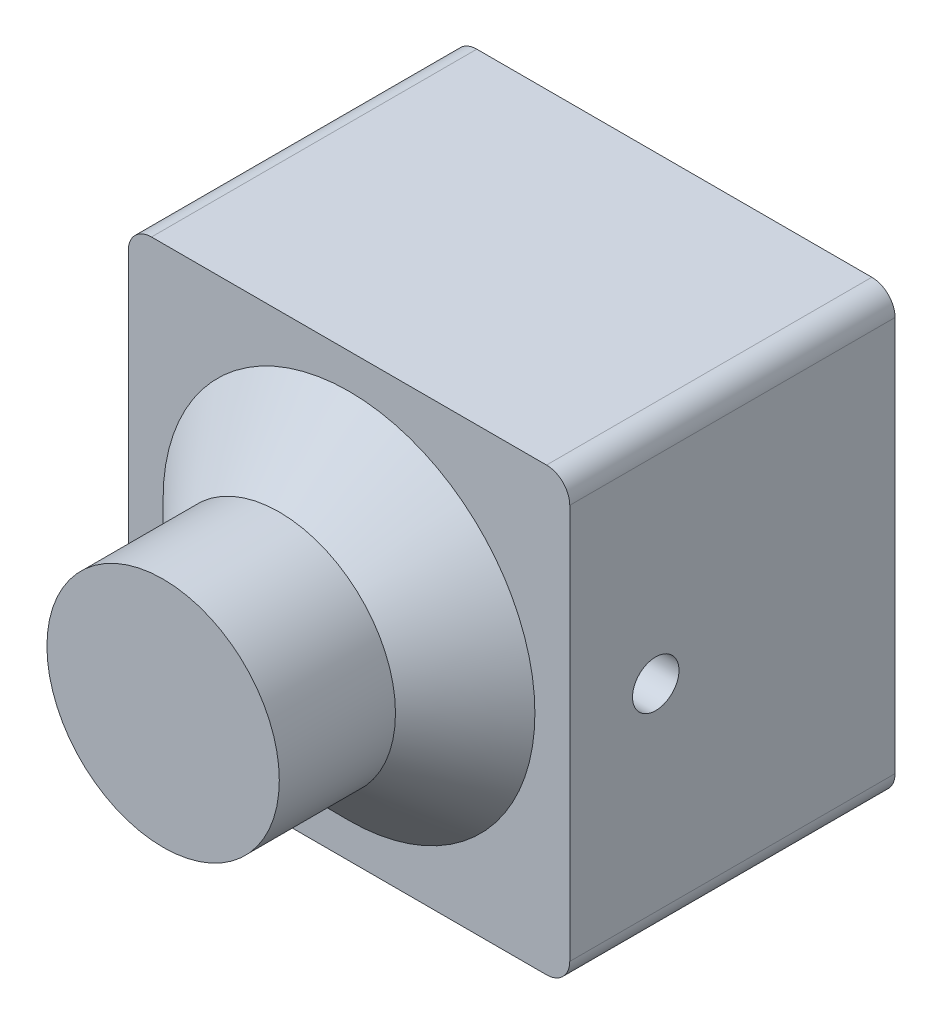
from build123d import *

# Parameters (mm, degrees)
SKETCH1_W           = 19
SKETCH1_H           = 19
BOSS_EXTRUDE1_DEPTH = 14
FILLET1_R           = 1
SKETCH2_R           = 5
BOSS_EXTRUDE2_DEPTH = 8
CHAMFER1_SIZE       = 3
SKETCH3_R           = 1
CUT_EXTRUDE1_DEPTH  = 5
CUT_EXTRUDE2_START  = -5
SKETCH4_R           = 1
CUT_EXTRUDE2_DEPTH  = 5


with BuildPart() as part:
    # Sketch1 → Boss-Extrude1 (new body)
    with BuildSketch(Plane.XY):
        with Locations((66.227433771, 51.961607523)):
            Rectangle(SKETCH1_W, SKETCH1_H)
    extrude(amount=BOSS_EXTRUDE1_DEPTH)

    # Fillet1
    fillet1_edges = [part.edges().sort_by_distance(p)[0] for p in [
        (56.727433771, 61.461607523, 7),
        (75.727433771, 61.461607523, 7),
        (75.727433771, 42.461607523, 7),
        (56.727433771, 42.461607523, 7),
    ]]
    fillet(fillet1_edges, radius=FILLET1_R)

    # Sketch2 → Boss-Extrude2 (add)
    with BuildSketch(Plane.XY.offset(14)):
        with Locations((66.227433771, 51.961607523)):
            Circle(SKETCH2_R)
    extrude(amount=BOSS_EXTRUDE2_DEPTH)

    # Chamfer1
    chamfer1_edges = [part.edges().sort_by_distance(p)[0] for p in [
        (61.227433771, 51.961607523, 14),
    ]]
    chamfer(chamfer1_edges, length=CHAMFER1_SIZE)

    # Sketch3 → Cut-Extrude1 (cut)
    with BuildSketch(Plane.ZY.offset(-56.727433771)):
        with Locations(Location((10.3, 51.961607523, 0), (0, 0, 270))):
            Circle(SKETCH3_R)
    extrude(amount=-CUT_EXTRUDE1_DEPTH, mode=Mode.SUBTRACT)

    # Sketch4 → Cut-Extrude2 (cut)
    with BuildSketch(Plane(origin=(75.727433771, 0, 0), x_dir=(0, 0, -1), z_dir=(1, 0, 0)).offset(CUT_EXTRUDE2_START)):
        with Locations(Location((-10.3, 51.961607523, 0), (0, 0, 270))):
            Circle(SKETCH4_R)
    extrude(amount=CUT_EXTRUDE2_DEPTH, mode=Mode.SUBTRACT)


solid = part.part
